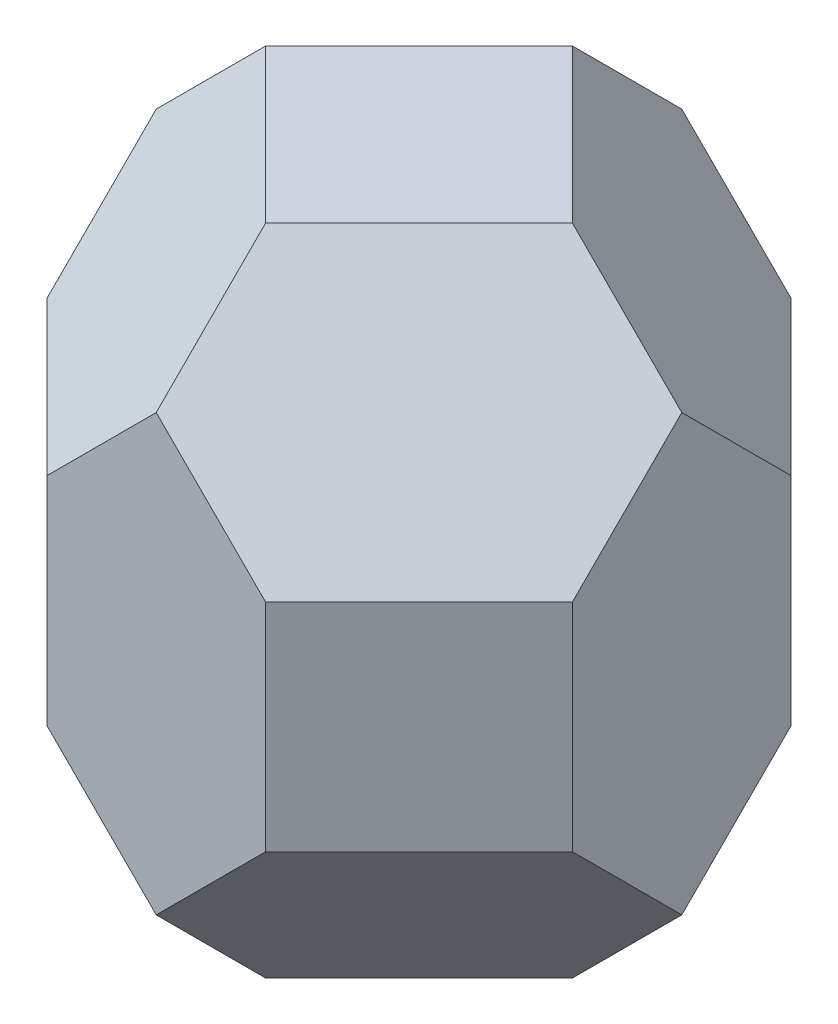
from build123d import *

# Parameters (mm, degrees)
BOSS_EXTRUDE1_DEPTH  = 170
SKETCH2_W            = 70.7106781
SKETCH2_H            = 70
BOSS_EXTRUDE2_DEPTH  = 85
SKETCH3_W            = 70.208152808
SKETCH3_H            = 70
BOSS_EXTRUDE3_DEPTH  = 170.208153
BOSS_EXTRUDE7_DEPTH  = 140.710678
SKETCH5_W            = 70.208152808
SKETCH5_H            = 70
BOSS_EXTRUDE8_DEPTH  = 170.208153
BOSS_EXTRUDE9_DEPTH  = 40
BOSS_EXTRUDE10_DEPTH = 40
BOSS_EXTRUDE11_DEPTH = 40
BOSS_EXTRUDE14_DEPTH = 40
BOSS_EXTRUDE15_DEPTH = 40
BOSS_EXTRUDE17_DEPTH = 40
BOSS_EXTRUDE20_DEPTH = 40
BOSS_EXTRUDE21_DEPTH = 40
BOSS_EXTRUDE22_DEPTH = 40
BOSS_EXTRUDE24_DEPTH = 40


with BuildPart() as part:
    # Sketch1 → Boss-Extrude1 (new body)
    with BuildSketch(Plane.XY):
        Polygon((0, 0), (-35.355339059, 35.355339059), (-35.355339059, 105.355339059), (0, 140.710678119), (35.355339059, 105.355339059), (35.355339059, 35.355339059), align=None)
    extrude(amount=BOSS_EXTRUDE1_DEPTH)



with BuildPart() as body_2:
    # Sketch2 → Boss-Extrude2 (new, symmetric)
    with BuildSketch(Plane(origin=(0, 0, 0), x_dir=(0, 0, -1), z_dir=(1, 0, 0))):
        with Locations((-85, 70.355339059)):
            Rectangle(SKETCH2_W, SKETCH2_H)
        Polygon((-85, 140.710678109), (-120.35533905, 105.355339059), (-49.64466095, 105.355339059), align=None)
        Polygon((-49.64466095, 35.355339059), (-120.35533905, 35.355339059), (-85, 9e-09), align=None)
    extrude(amount=BOSS_EXTRUDE2_DEPTH, both=True)


with BuildPart() as part_1:
    add(part.part)

    add(body_2.part)  # Boss-Extrude3 merges body 2
    # Sketch3 → Boss-Extrude3 (add)
    with BuildSketch(Plane(origin=(17.677669533, 0, -17.67766953), x_dir=(-0.7071067811201199, 0, -0.7071067812529752), z_dir=(0.7071067812529752, 0, -0.7071067811201199))):
        with Locations((-60.104076402, 70.355339059)):
            Rectangle(SKETCH3_W, SKETCH3_H)
    extrude(amount=-BOSS_EXTRUDE3_DEPTH)

    # Sketch4 → Boss-Extrude7 (add)
    with BuildSketch(Plane(origin=(0, 140.710678119, 0), x_dir=(1, 0, 0), z_dir=(0, 1, 0))):
        Polygon((0, -35.355339059), (-49.64466095, -85.000000019), (0, -134.644660959), (49.64466095, -85), align=None)
    extrude(amount=-BOSS_EXTRUDE7_DEPTH)

    # Sketch5 → Boss-Extrude8 (add)
    with BuildSketch(Plane(origin=(-17.677669533, 0, -17.67766953), x_dir=(-0.7071067811201204, 0, 0.7071067812529747), z_dir=(-0.7071067812529747, 0, -0.7071067811201204))):
        with Locations((60.104076402, 70.355339059)):
            Rectangle(SKETCH5_W, SKETCH5_H)
    extrude(amount=-BOSS_EXTRUDE8_DEPTH)

    # Sketch7 → Boss-Extrude9 (add)
    with BuildSketch(Plane(origin=(0, 0, 0), x_dir=(0.8164965809277276, -0.4082482904638617, -0.4082482904638614), z_dir=(0.5773502691896236, 0.577350269189627, 0.5773502691896267))):
        Polygon((-104.103314072, -10.104076407), (-104.103314072, -60.104076394), (-60.802043892, -85.104076383), (-9e-09, -49.999999976), (0, 0), (-43.301270189, 25), align=None)
    extrude(amount=BOSS_EXTRUDE9_DEPTH)

    # Sketch8 → Boss-Extrude10 (add)
    with BuildSketch(Plane(origin=(0, 0, 0), x_dir=(-0.8164965809277275, -0.4082482904638613, -0.4082482904638619), z_dir=(0.5773502691896238, -0.5773502691896264, -0.5773502691896273))):
        Polygon((0, 0), (-104.103314072, -60.104076394), (-104.103314072, -10.104076407), (-43.301270189, 25), align=None)
        Polygon((0, 0), (5e-09, -50), (-60.802043877, -85.104076407), (-104.103314072, -60.104076394), align=None)
    extrude(amount=-BOSS_EXTRUDE10_DEPTH)

    # Sketch9 → Boss-Extrude11 (add)
    with BuildSketch(Plane(origin=(-8e-09, -35.355339028, -1e-08), x_dir=(-1.0, 2.324833960682746e-10, 0), z_dir=(-2.324833960682746e-10, -1.0, -2.9511459186104094e-10))):
        Polygon((-49.644660948, -85.000000014), (-1e-09, -35.355339056), (49.644660943, -85.000000003), (-1.9e-08, -134.644660946), align=None)
    extrude(amount=-BOSS_EXTRUDE11_DEPTH)

    # Sketch11 → Boss-Extrude14 (add)
    with BuildSketch(Plane(origin=(-56.666666664, -56.666666664, 56.666666669), x_dir=(0.8164965809396947, -0.408248290433944, 0.4082482904698449), z_dir=(-0.5773502691726996, -0.577350269172703, 0.5773502692234747))):
        Polygon((-34.701104701, 110.104076387), (-34.701104696, 60.1040764), (69.40220938, 120.208152796), (26.100939191, 145.208152798), align=None)
        Polygon((69.402209374, 70.208152796), (8.600165476, 35.104076398), (-34.701104696, 60.1040764), (69.40220938, 120.208152796), align=None)
    extrude(amount=-BOSS_EXTRUDE14_DEPTH)

    # Sketch12 → Boss-Extrude15 (add)
    with BuildSketch(Plane(origin=(56.666666687, -56.666666659, 56.666666659), x_dir=(0.40824829049722544, -0.40824829029705206, -0.8164965809944503), z_dir=(0.5773502693783509, -0.5773502690952631, 0.5773502690952634))):
        Polygon((-78.00237487, 85.104076392), (-138.804418754, 50.000000005), (-138.804418765, 6e-09), (-95.503148581, -25.000000002), (-34.701104701, 10.104076381), (-34.701104696, 60.104076393), align=None)
    extrude(amount=-BOSS_EXTRUDE15_DEPTH)

    # Sketch14 → Boss-Extrude17 (add)
    with BuildSketch(Plane(origin=(103.57022604, 103.57022604, 103.57022604), x_dir=(-0.8164965809277273, 0.4082482904638616, 0.4082482904638622), z_dir=(-0.5773502691896242, -0.5773502691896262, -0.5773502691896271))):
        Polygon((22.743789099, 39.393398276), (126.847103171, -20.710678119), (83.545832973, -45.710678114), (22.743789091, -10.606601707), align=None)
        Polygon((126.847103156, 29.289321886), (66.045059265, 64.393398279), (22.743789099, 39.393398276), (126.847103171, -20.710678119), align=None)
    extrude(amount=BOSS_EXTRUDE17_DEPTH)

    # Sketch15 → Boss-Extrude20 (add)
    with BuildSketch(Plane(origin=(-103.570226036, 103.570226036, 103.570226036), x_dir=(0.8164965809277289, 0.4082482904638593, 0.4082482904638611), z_dir=(-0.5773502691896217, 0.5773502691896265, 0.5773502691896291))):
        Polygon((126.847103171, -20.710678119), (83.545832973, -45.710678114), (22.743789099, -10.606601711), (22.743789099, 39.393398276), align=None)
        Polygon((66.045059273, 64.393398274), (126.847103156, 29.289321886), (126.847103171, -20.710678119), (22.743789099, 39.393398276), align=None)
    extrude(amount=-BOSS_EXTRUDE20_DEPTH)

    # Sketch18 → Boss-Extrude21 (add)
    with BuildSketch(Plane(origin=(-6e-09, 176.066017148, -3.1e-08), x_dir=(1.0, 3.131573767451649e-11, 0), z_dir=(-3.131573767451649e-11, 1.0, -1.7761984508401238e-10))):
        Polygon((-3e-09, -134.64466096), (49.644660968, -85.000000023), (-49.644660947, -85.000000026), align=None)
        Polygon((-49.644660947, -85.000000026), (-3e-09, -35.355339093), (49.644660968, -85.000000023), align=None)
    extrude(amount=-BOSS_EXTRUDE21_DEPTH)

    # Sketch19 → Boss-Extrude22 (add)
    with BuildSketch(Plane(origin=(46.90355937, 46.90355937, -46.90355937), x_dir=(-0.8164965809277273, 0.4082482904638619, -0.4082482904638618), z_dir=(-0.5773502691896241, -0.577350269189627, 0.5773502691896263))):
        Polygon((14.143623603, -74.497474683), (-46.65842028, -109.601551091), (-46.65842028, -159.601551077), (-3.357150107, -184.601551069), (57.444893789, -149.497474668), (57.444893792, -99.497474683), align=None)
    extrude(amount=BOSS_EXTRUDE22_DEPTH)

    # Sketch21 → Boss-Extrude24 (add)
    with BuildSketch(Plane(origin=(-46.903559392, 46.903559378, -46.903559356), x_dir=(-0.4082482903558565, 0.40824829023639164, 0.816496581095465), z_dir=(-0.5773502693927096, 0.5773502692237606, -0.5773502689524072))):
        Polygon((161.548207823, 89.393398286), (100.746163943, 124.497474679), (57.44489378, 99.497474694), (57.444893784, 49.497474694), (118.246937674, 14.393398298), (161.54820785, 39.393398295), align=None)
    extrude(amount=-BOSS_EXTRUDE24_DEPTH)


solid = part_1.part
